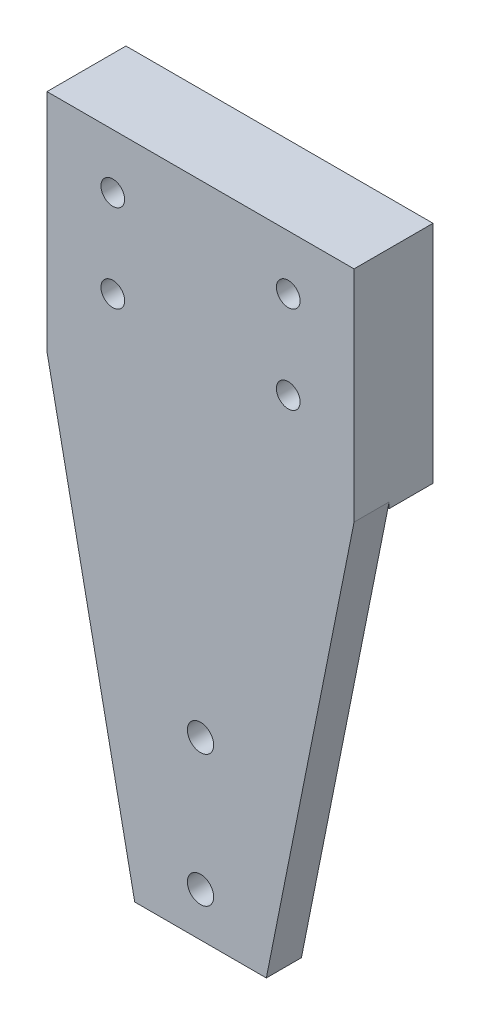
from build123d import *

# Parameters (mm, degrees)
SKETCH1_R           = 3.81
SKETCH1_R_2         = 3.429
BOSS_EXTRUDE1_DEPTH = 10.16
SKETCH2_W           = 88.9
SKETCH2_H           = 65.208376681
BOSS_EXTRUDE2_DEPTH = 12.7
CUT_EXTRUDE1_START  = -12.7
SKETCH1_3_R         = 3.429
CUT_EXTRUDE1_DEPTH  = 12.7


with BuildPart() as part:
    # Sketch1 → Boss-Extrude1 (new body)
    with BuildSketch(Plane.XY):
        Polygon((0, 0), (38.1, 0), (63.5, 127), (63.5, 190.5), (-25.4, 190.5), (-25.4, 125.291623319), align=None)
        with Locations((19.05, 12.7)):
            Circle(SKETCH1_R, mode=Mode.SUBTRACT)
        with Locations((19.05, 50.8)):
            Circle(SKETCH1_R, mode=Mode.SUBTRACT)
        with Locations((-6.35, 174.687730396)):
            Circle(SKETCH1_R_2, mode=Mode.SUBTRACT)
        with Locations((-6.35, 149.287730396)):
            Circle(SKETCH1_R_2, mode=Mode.SUBTRACT)
        with Locations(Location((44.45, 149.287730396, 0), (0, 0, 180))):
            Circle(SKETCH1_R_2, mode=Mode.SUBTRACT)
        with Locations(Location((44.45, 174.687730396, 0), (0, 0, 180))):
            Circle(SKETCH1_R_2, mode=Mode.SUBTRACT)
    extrude(amount=BOSS_EXTRUDE1_DEPTH)

    # Sketch2 → Boss-Extrude2 (add)
    with BuildSketch(Plane(origin=(0, 0, 0), x_dir=(-1, 0, 0), z_dir=(0, 0, -1))):
        with Locations((-19.05, 157.895811659)):
            Rectangle(SKETCH2_W, SKETCH2_H)
    extrude(amount=BOSS_EXTRUDE2_DEPTH)

    # Sketch1<3> → Cut-Extrude1 (cut)
    with BuildSketch(Plane.XY.offset(CUT_EXTRUDE1_START)):
        with Locations(Location((-6.35, 174.687730396, 0), (0, 0, 180))):
            Circle(SKETCH1_3_R)
        with Locations(Location((-6.35, 149.287730396, 0), (0, 0, 180))):
            Circle(SKETCH1_3_R)
        with Locations(Location((44.45, 149.287730396, 0), (0, 0, 180))):
            Circle(SKETCH1_3_R)
        with Locations(Location((44.45, 174.687730396, 0), (0, 0, 180))):
            Circle(SKETCH1_3_R)
    extrude(amount=CUT_EXTRUDE1_DEPTH, mode=Mode.SUBTRACT)


solid = part.part
